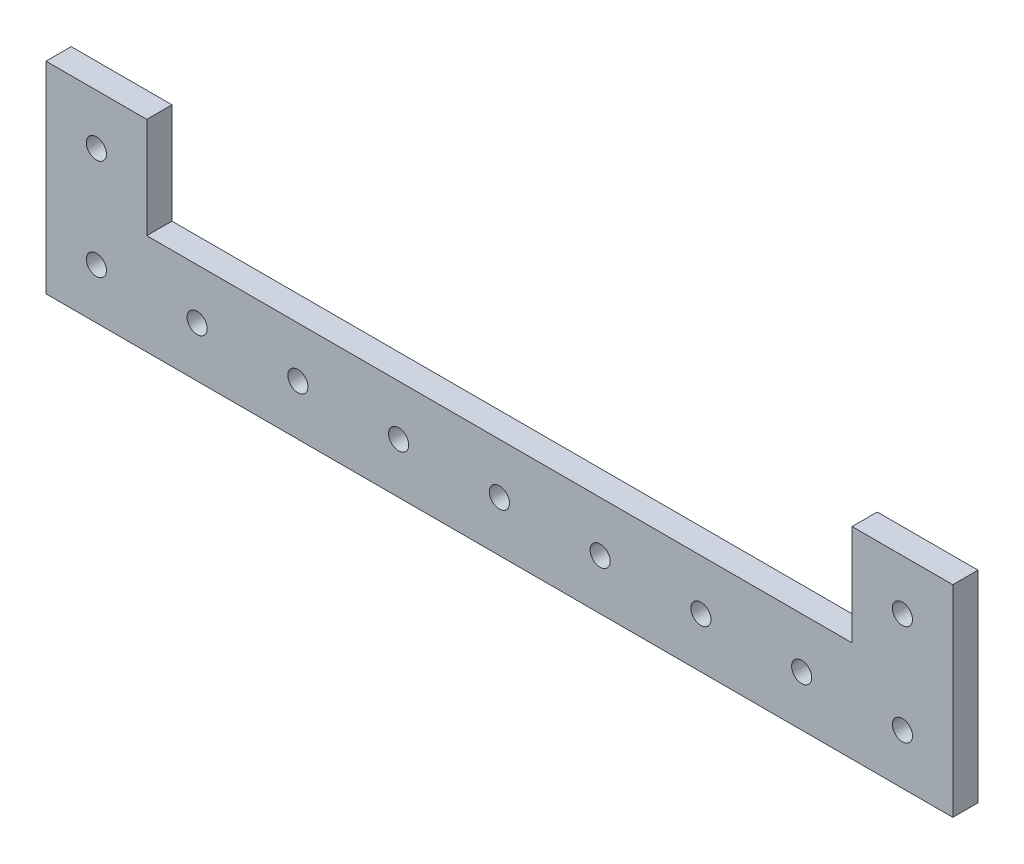
from build123d import *

# Parameters (mm, degrees)
BOSS_EXTRUDE1_DEPTH = 6.35
SKETCH2_R           = 2.54
CUT_EXTRUDE1_DEPTH  = 235.26250767


with BuildPart() as part:
    # Sketch1 → Boss-Extrude1 (new body)
    with BuildSketch(Plane.XY):
        Polygon((0, 0), (0, 50.8), (25.4, 50.8), (25.4, 25.4), (203.2, 25.4), (203.2, 50.8), (228.6, 50.8), (228.6, 0), align=None)
    extrude(amount=BOSS_EXTRUDE1_DEPTH)

    # Sketch2 → Cut-Extrude1 (cut, through all)
    with BuildSketch(Plane.XY.offset(6.35)):
        with Locations((12.7, 38.1)):
            Circle(SKETCH2_R)
        with Locations((12.7, 12.7)):
            Circle(SKETCH2_R)
        with Locations((38.1, 12.7)):
            Circle(SKETCH2_R)
        with Locations((63.5, 12.7)):
            Circle(SKETCH2_R)
        with Locations((88.9, 12.7)):
            Circle(SKETCH2_R)
        with Locations((114.3, 12.7)):
            Circle(SKETCH2_R)
        with Locations((139.7, 12.7)):
            Circle(SKETCH2_R)
        with Locations((165.1, 12.7)):
            Circle(SKETCH2_R)
        with Locations((190.5, 12.7)):
            Circle(SKETCH2_R)
        with Locations((215.9, 12.7)):
            Circle(SKETCH2_R)
        with Locations(Location((215.9, 38.1, 0), (0, 0, 180))):
            Circle(SKETCH2_R)
    extrude(amount=-CUT_EXTRUDE1_DEPTH, mode=Mode.SUBTRACT)


solid = part.part
